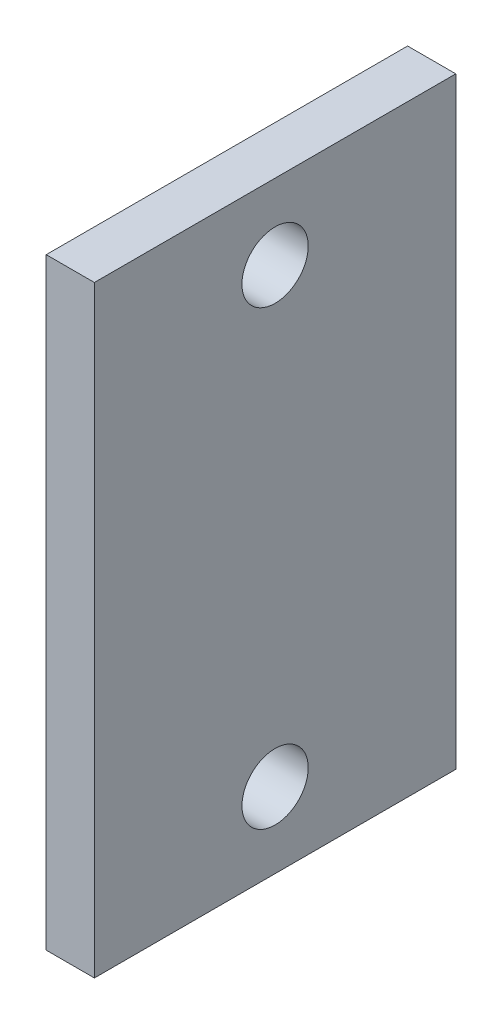
from build123d import *

# Parameters (mm, degrees)
SKETCH1_W           = 12
SKETCH1_H           = 20
BOARD_DEPTH         = 1.6
SKETCH2_W           = 2.8
SKETCH2_H           = 3.5
UV_SENSOR_DEPTH     = 1.2
HOLES_M2_DEPTH      = 12.771151176
HOLES_M2_DEPTH_BACK = 12.771151176
SKETCH3_R           = 1.1


with BuildPart() as part:
    # Sketch1 → Board (new body)
    with BuildSketch(Plane(origin=(0, 0, 0), x_dir=(0, 0, -1), z_dir=(1, 0, 0))):
        Rectangle(SKETCH1_W, SKETCH1_H)
    extrude(amount=BOARD_DEPTH)

    # Sketch2 → UV_Sensor (add)
    with BuildSketch(Plane(origin=(0, 0, 0), x_dir=(0, 0, -1), z_dir=(1, 0, 0))):
        Rectangle(SKETCH2_W, SKETCH2_H)
    extrude(amount=-UV_SENSOR_DEPTH)

    # Sketch3 → Holes_M2 (cut, two sides: drawn at the far end of the back side and taken through both)
    with BuildSketch(Plane(origin=(0, 0, 0), x_dir=(0, 0, -1), z_dir=(1, 0, 0)).offset(-HOLES_M2_DEPTH_BACK)):
        with Locations(Location((0, -7.5, 0), (0, 0, 180))):
            Circle(SKETCH3_R)
        with Locations(Location((0, 7.5, 0), (0, 0, 180))):
            Circle(SKETCH3_R)
    extrude(amount=HOLES_M2_DEPTH + HOLES_M2_DEPTH_BACK, mode=Mode.SUBTRACT)


solid = part.part
